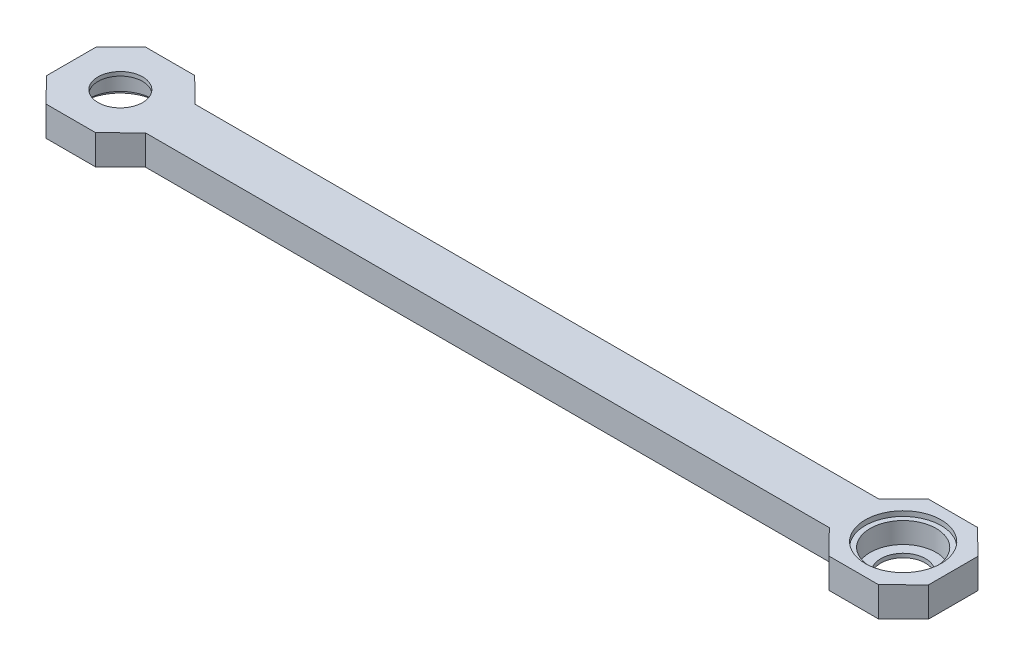
from build123d import *

# Parameters (mm, degrees)
SKETCH_1_R          = 4.5
EXTRUDE_1_DEPTH     = 6
SKETCH_2_R          = 6.65
CUT_EXTRUDE_1_DEPTH = 5.2
SKETCH_3_R          = 7.65
CUT_EXTRUDE_2_DEPTH = 1
SKETCH_5_R          = 6.65
CUT_EXTRUDE_3_DEPTH = 5.2
SKETCH_6_R          = 7.65
CUT_EXTRUDE_4_DEPTH = 1


with BuildPart() as part:
    # 草图1 → 凸台-拉伸1 (new body)
    with BuildSketch(Plane(origin=(0, 0, 0), x_dir=(1, 0, 0), z_dir=(0, 1, 0))):
        Polygon((-65.26232397, 5), (-70.363344484, 10), (-80.363344484, 10), (-85.26232397, 5), (-85.26232397, -5), (-80.363344484, -10), (-70.363344484, -10), (-65.26232397, -5), (72.73767603, -5), (77.636655516, -10), (87.636655516, -10), (92.739759147, -5), (92.739759147, 5), (87.636655516, 10), (77.636655516, 10), (72.73767603, 5), align=None)
        with Locations(Location((-75.363344484, 0, 0), (0, 0, 270))):
            Circle(SKETCH_1_R, mode=Mode.SUBTRACT)
        with Locations(Location((82.636655516, 0, 0), (0, 0, 270))):
            Circle(SKETCH_1_R, mode=Mode.SUBTRACT)
    extrude(amount=EXTRUDE_1_DEPTH)

    # 草图2 → 切除-拉伸1 (cut)
    with BuildSketch(Plane(origin=(0, 6, 0), x_dir=(1, 0, 0), z_dir=(0, 1, 0))):
        with Locations(Location((82.636655516, 0, 0), (0, 0, 270))):
            Circle(SKETCH_2_R)
    extrude(amount=-CUT_EXTRUDE_1_DEPTH, mode=Mode.SUBTRACT)

    # 草图3 → 切除-拉伸2 (cut)
    with BuildSketch(Plane(origin=(0, 6, 0), x_dir=(1, 0, 0), z_dir=(0, 1, 0))):
        with Locations(Location((82.636655516, 0, 0), (0, 0, 270))):
            Circle(SKETCH_3_R)
    extrude(amount=-CUT_EXTRUDE_2_DEPTH, mode=Mode.SUBTRACT)

    # 草图5 → 切除-拉伸3 (cut)
    with BuildSketch(Plane.XZ):
        with Locations(Location((-75.363344484, 0, 0), (0, 0, 270))):
            Circle(SKETCH_5_R)
    extrude(amount=-CUT_EXTRUDE_3_DEPTH, mode=Mode.SUBTRACT)

    # 草图6 → 切除-拉伸4 (cut)
    with BuildSketch(Plane.XZ):
        with Locations(Location((-75.363344484, 0, 0), (0, 0, 270))):
            Circle(SKETCH_6_R)
    extrude(amount=-CUT_EXTRUDE_4_DEPTH, mode=Mode.SUBTRACT)


solid = part.part
